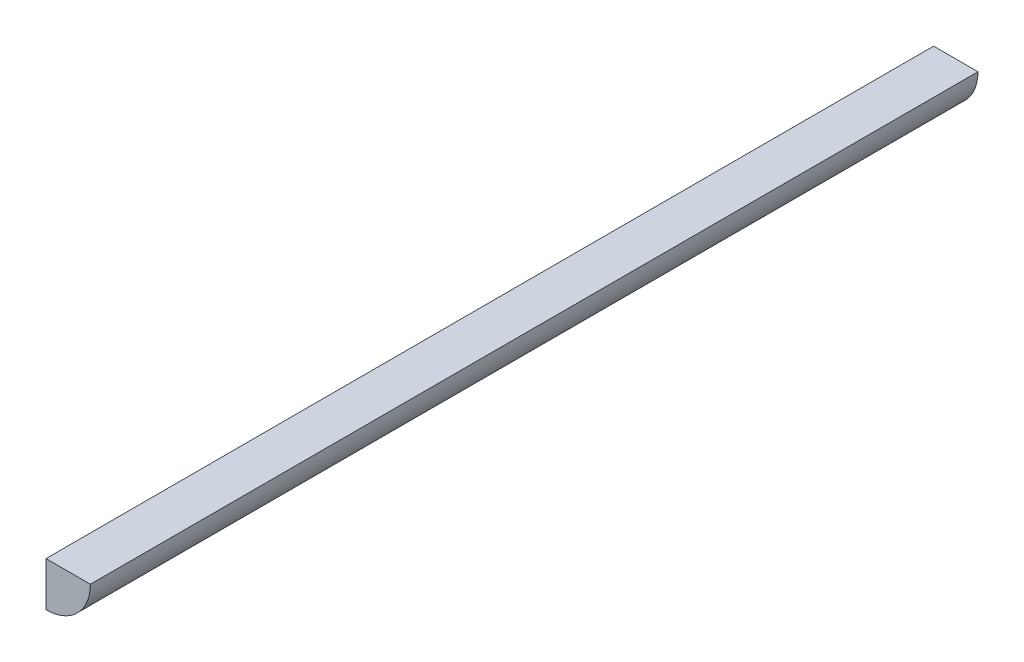
from build123d import *

# Parameters (mm, degrees)
BOSS_EXTRUDE1_DEPTH = 200


with BuildPart() as part:
    # Sketch1 → Boss-Extrude1 (new, symmetric)
    with BuildSketch(Plane.XY):
        with BuildLine():
            Line((0, 0), (20, 0))
            ThreePointArc((20, 0), (14.142135624, -14.142135624), (0, -20))
            Line((0, -20), (0, 0))
        make_face()
    extrude(amount=BOSS_EXTRUDE1_DEPTH, both=True)


solid = part.part
